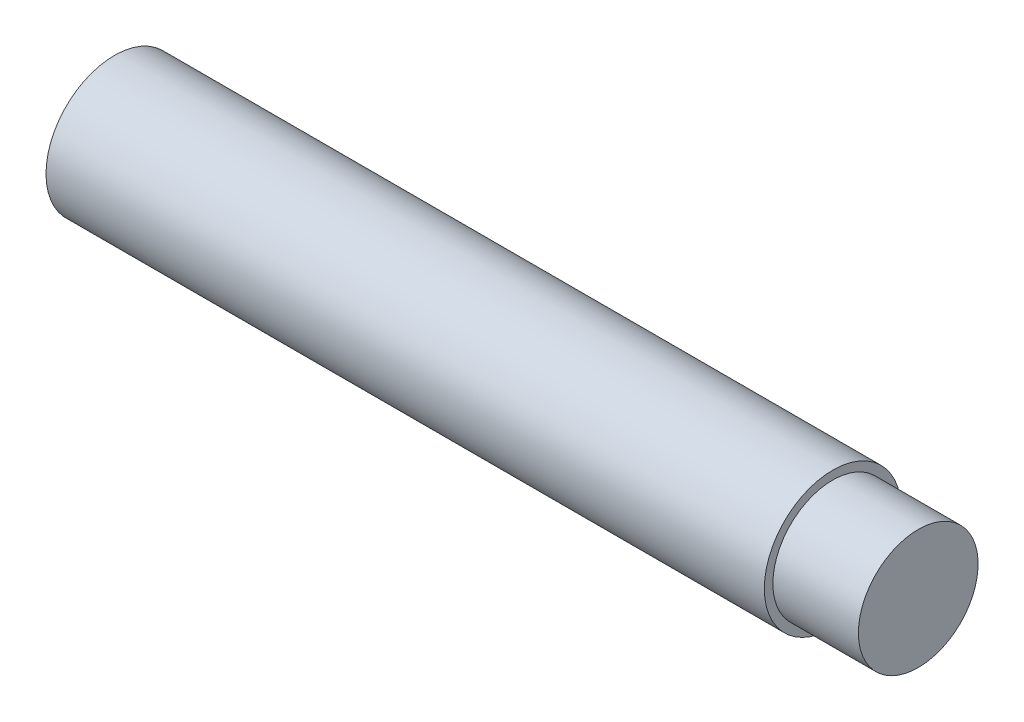
from build123d import *


with BuildPart() as part:
    # Sketch1 → Revolve1 (revolve)
    with BuildSketch(Plane.XY, mode=Mode.PRIVATE) as revolve1_sk:
        Polygon((23.5, 0), (-23.5, 0), (-23.5, 4), (18.5, 4), (18.5, 3.5), (23.5, 3.5), align=None)
    revolve(revolve1_sk.sketch.rotate(Axis((-23.5, 0, 0), (1, 0, 0)), 90), axis=Axis((-23.5, 0, 0), (1, 0, 0)))


solid = part.part
